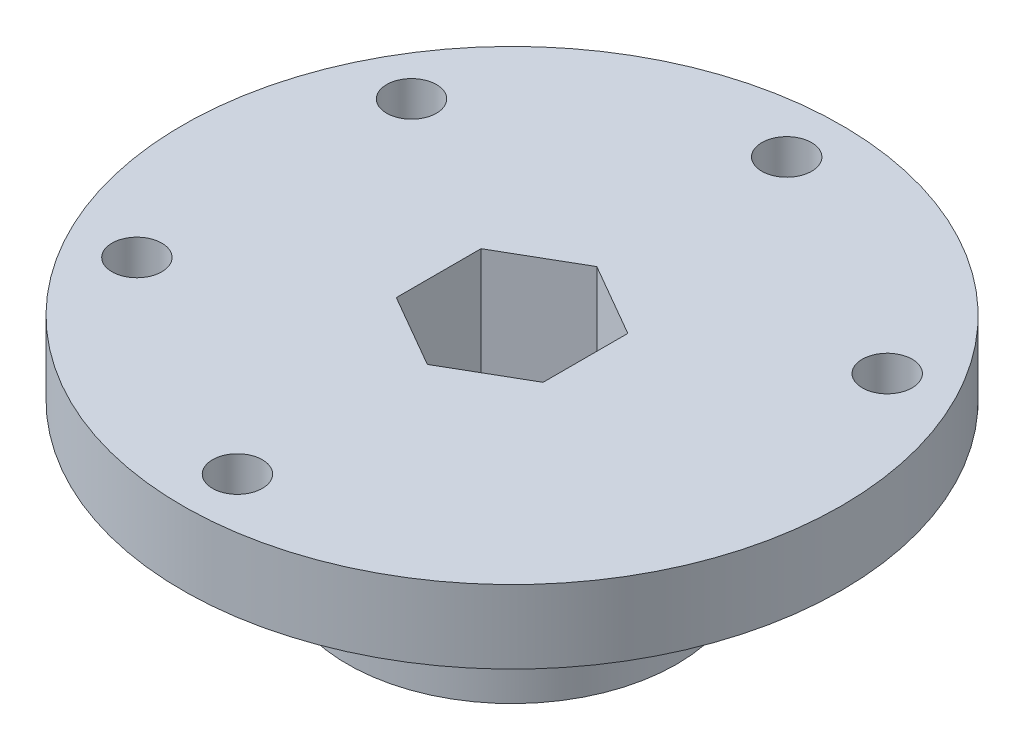
from build123d import *

# Parameters (mm, degrees)
SKETCH1_W             = 28.575
SKETCH1_H             = 6.35
SKETCH2_R             = 14.2748
BOSS_EXTRUDE1_DEPTH   = 12.7
CUT_EXTRUDE1_DEPTH    = 45.676210112
F_8_CLEARANCE_HOLE1_D = 4.318


with BuildPart() as part:
    # Sketch1 → Revolve1 (revolve)
    with BuildSketch(Plane.XY):
        with Locations((14.2875, -3.175)):
            Rectangle(SKETCH1_W, SKETCH1_H)
    revolve(axis=Axis((0, 0, 0), (0, -1, 0)))

    # Sketch2 → Boss-Extrude1 (add)
    with BuildSketch(Plane.XZ.offset(6.35)):
        with Locations(Location((0, 0, 0), (0, 0, 180))):
            Circle(SKETCH2_R)
    extrude(amount=BOSS_EXTRUDE1_DEPTH)

    # Sketch3 → Cut-Extrude1 (cut, through all)
    with BuildSketch(Plane(origin=(0, 0, 0), x_dir=(-1, 0, 0), z_dir=(0, 1, 0))):
        Polygon((0, -7.347013116), (6.3627, -3.673506558), (6.3627, 3.673506558), (0, 7.347013116), (-6.3627, 3.673506558), (-6.3627, -3.673506558), align=None)
    extrude(amount=-CUT_EXTRUDE1_DEPTH, mode=Mode.SUBTRACT)

    # #8 Clearance Hole1 (through all)
    with Locations(Plane.XZ.offset(6.35)):
        with Locations((-20.622229928, -11.90625), (0, 23.8125), (0, -23.8125), (-20.622229928, 11.90625), (20.622229928, -11.90625)):
            Hole(F_8_CLEARANCE_HOLE1_D / 2)


solid = part.part
